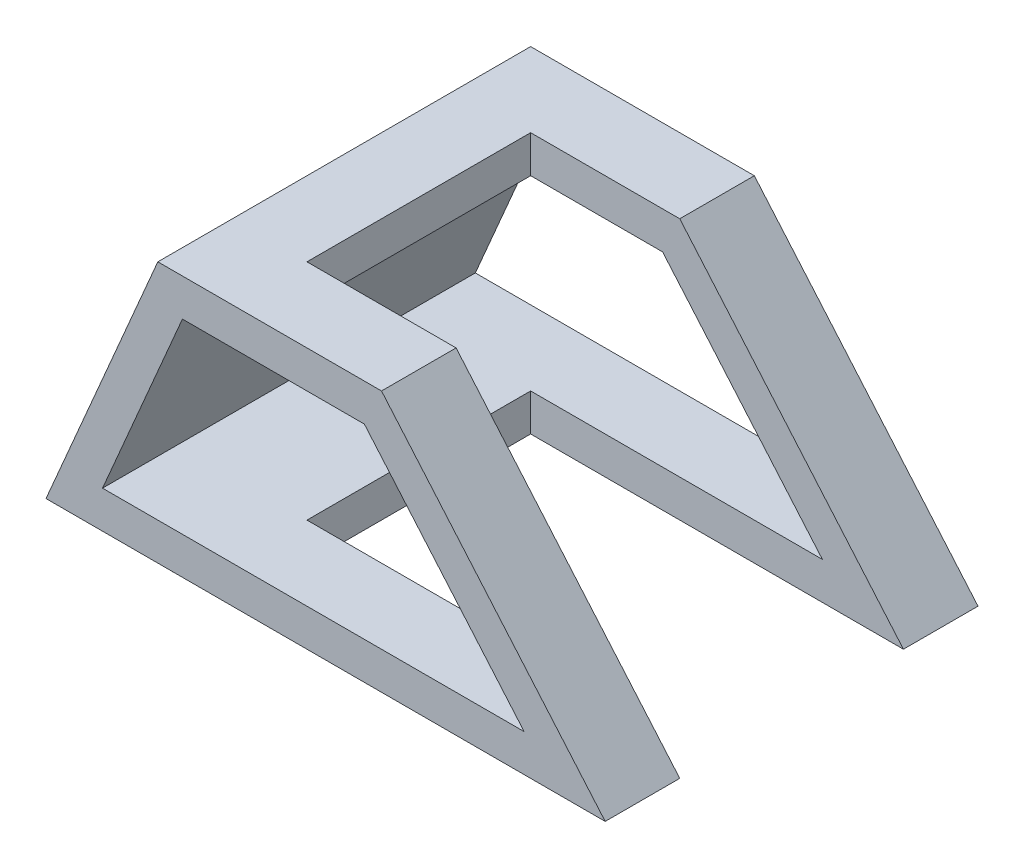
from build123d import *

# Parameters (mm, degrees)
BOSS_EXTRUDE1_DEPTH = 50
SKETCH2_W           = 100
SKETCH2_H           = 60
CUT_EXTRUDE1_DEPTH  = 173.916164658


with BuildPart() as part:
    # Sketch1 → Boss-Extrude1 (new, symmetric)
    with BuildSketch(Plane.XY):
        Polygon((0, 0), (30, 70), (90, 70), (150, 0), align=None)
        Polygon((15.165390151, 10), (36.59396158, 60), (85.400650775, 60), (128.257793632, 10), align=None, mode=Mode.SUBTRACT)
    extrude(amount=BOSS_EXTRUDE1_DEPTH, both=True)

    # Sketch2 → Cut-Extrude1 (cut, through all)
    with BuildSketch(Plane(origin=(0, 0, 0), x_dir=(1, 0, 0), z_dir=(0, 1, 0))):
        with Locations((100, 0)):
            Rectangle(SKETCH2_W, SKETCH2_H)
    extrude(amount=CUT_EXTRUDE1_DEPTH, mode=Mode.SUBTRACT)


solid = part.part
